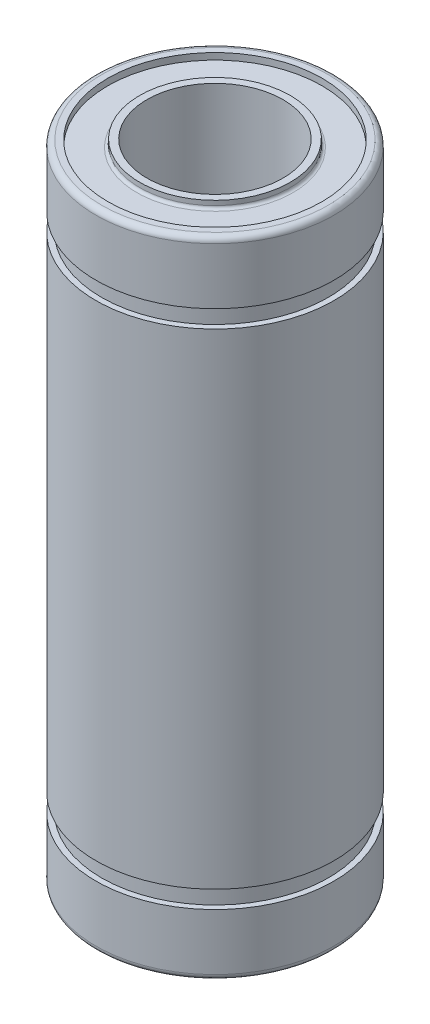
from build123d import *


with BuildPart() as part:
    # Sketch1 → Revolve1 (revolve)
    with BuildSketch(Plane.XY, mode=Mode.PRIVATE) as revolve1_sk:
        with BuildLine():
            Line((6.635, 28.4804), (6, 28.4804))
            Line((6, 28.4804), (6, -28.4804))
            Line((6, -28.4804), (6.635, -28.4804))
            Line((6.635, -28.4804), (6.635, -28.074))
            ThreePointArc((6.635, -28.074), (6.709394878, -27.894394878), (6.889, -27.82))
            Line((6.889, -27.82), (9.435, -27.82))
            Line((9.435, -27.82), (9.435, -28.4))
            Line((9.435, -28.4), (9.982, -28.4))
            ThreePointArc((9.982, -28.4), (10.341210245, -28.251210245), (10.49, -27.892))
            Line((10.49, -27.892), (10.49, -22.93))
            Line((10.49, -22.93), (10, -22.93))
            Line((10, -22.93), (10, -21.38))
            Line((10, -21.38), (10.49, -21.38))
            Line((10.49, -21.38), (10.49, 21.38))
            Line((10.49, 21.38), (10, 21.38))
            Line((10, 21.38), (10, 22.93))
            Line((10, 22.93), (10.49, 22.93))
            Line((10.49, 22.93), (10.49, 27.892))
            ThreePointArc((10.49, 27.892), (10.341210245, 28.251210245), (9.982, 28.4))
            Line((9.982, 28.4), (9.435, 28.4))
            Line((9.435, 28.4), (9.435, 27.82))
            Line((9.435, 27.82), (6.889, 27.82))
            ThreePointArc((6.889, 27.82), (6.709394878, 27.894394878), (6.635, 28.074))
            Line((6.635, 28.074), (6.635, 28.4804))
        make_face()
    revolve(revolve1_sk.sketch.rotate(Axis((0, 28.4804, 0), (0, -1, 0)), 270), axis=Axis((0, 28.4804, 0), (0, -1, 0)))


solid = part.part
